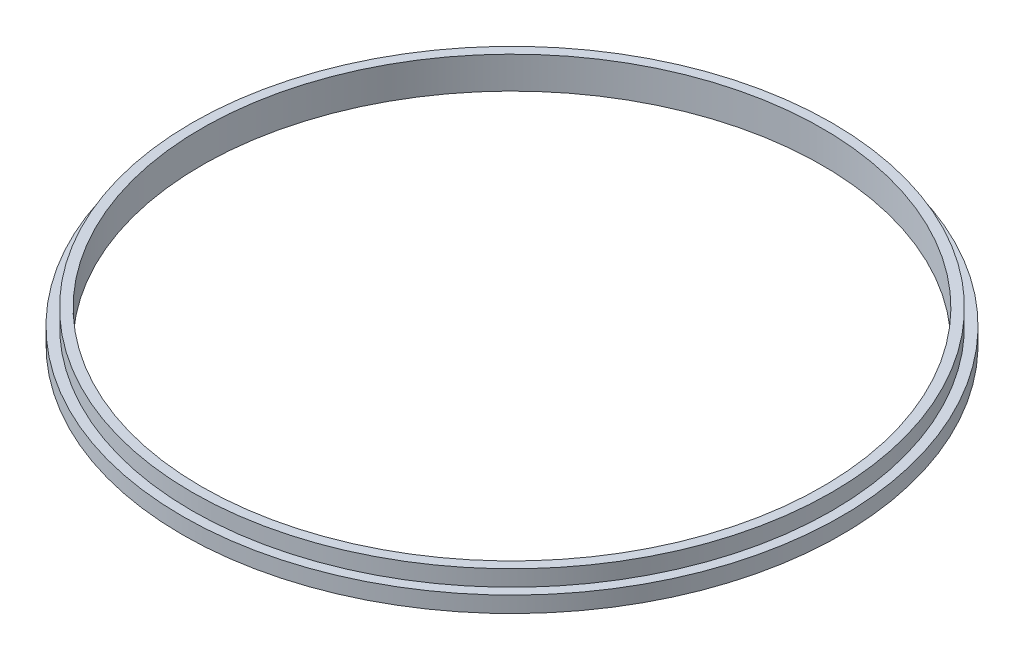
from build123d import *

# Parameters (mm, degrees)
SKETCH_1_R      = 103
SKETCH_1_R_2    = 97
EXTRUDE_1_DEPTH = 5
SKETCH_2_R      = 100
SKETCH_2_R_2    = 97
EXTRUDE_2_DEPTH = 5


with BuildPart() as part:
    # 草图1 → 凸台-拉伸1 (new body)
    with BuildSketch(Plane(origin=(0, 0, 0), x_dir=(1, 0, 0), z_dir=(0, 1, 0))):
        with Locations(Location((0, 0, 0), (0, 0, 270))):
            Circle(SKETCH_1_R)
        with Locations(Location((0, 0, 0), (0, 0, 270))):
            Circle(SKETCH_1_R_2, mode=Mode.SUBTRACT)
    extrude(amount=EXTRUDE_1_DEPTH)

    # 草图2 → 凸台-拉伸2 (add)
    with BuildSketch(Plane(origin=(0, 5, 0), x_dir=(1, 0, 0), z_dir=(0, 1, 0))):
        with Locations(Location((0, 0, 0), (0, 0, 270))):
            Circle(SKETCH_2_R)
        with Locations(Location((0, 0, 0), (0, 0, 270))):
            Circle(SKETCH_2_R_2, mode=Mode.SUBTRACT)
    extrude(amount=EXTRUDE_2_DEPTH)


solid = part.part
